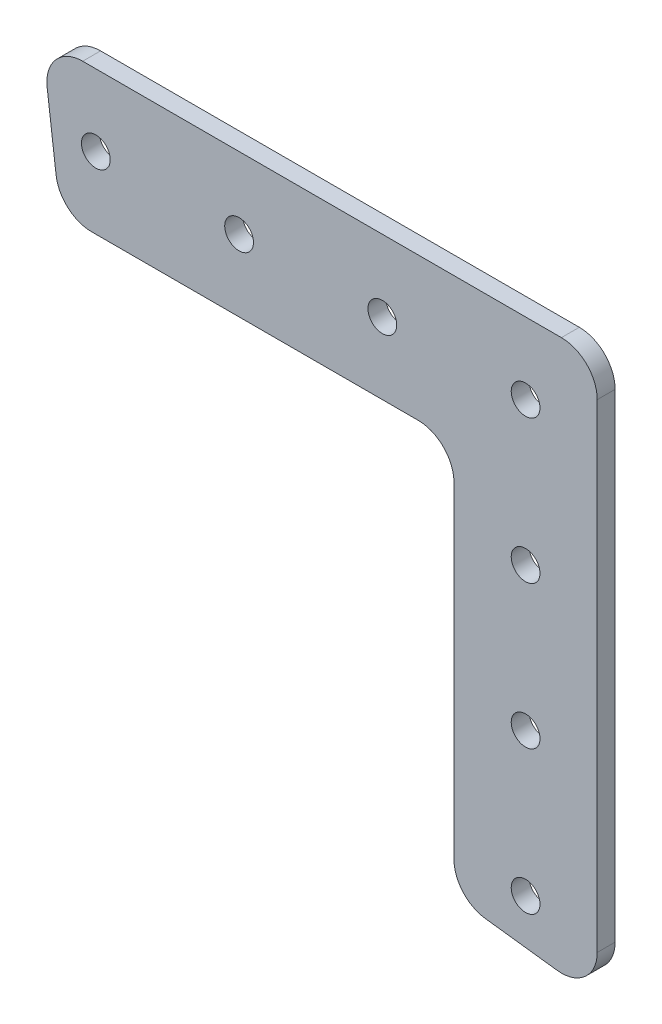
from build123d import *

# Parameters (mm, degrees)
BOSS_EXTRUDE1_DEPTH        = 3.175
FILLET1_R                  = 6.35
F_10_CLEARANCE_HOLE1_D     = 5.1054
F_10_CLEARANCE_HOLE1_DEPTH = 9.906
F_10_CLEARANCE_HOLE1_TIP   = 1.533816902


with BuildPart() as part:
    # Sketch1 → Boss-Extrude1 (new body)
    with BuildSketch(Plane.XY):
        with BuildLine():
            Line((-12.7, 247.65), (-12.7, 317.5))
            Line((-12.7, 317.5), (-82.55, 317.5))
            Line((-82.55, 317.5), (-84.832797429, 335.762379435))
            ThreePointArc((-84.832797429, 335.762379435), (-83.292289329, 340.752446277), (-78.531832912, 342.9))
            Line((-78.531832912, 342.9), (6.35, 342.9))
            ThreePointArc((6.35, 342.9), (10.840128061, 341.040128061), (12.7, 336.55))
            Line((12.7, 336.55), (12.7, 251.668167088))
            ThreePointArc((12.7, 251.668167088), (10.552446277, 246.907710671), (5.562379435, 245.367202571))
            Line((5.562379435, 245.367202571), (-12.7, 247.65))
        make_face()
    extrude(amount=BOSS_EXTRUDE1_DEPTH)

    # Fillet1
    fillet1_edges = [part.edges().sort_by_distance(p)[0] for p in [
        (-12.7, 247.65, 1.5875),
        (-12.7, 317.5, 1.5875),
        (-82.55, 317.5, 1.5875),
    ]]
    fillet(fillet1_edges, radius=FILLET1_R)

    # #10 Clearance Hole1
    with Locations(Plane(origin=(0, 0, 0), x_dir=(-1, 0, 0), z_dir=(0, 0, -1))):
        with Locations((0, 330.2), (0, 304.8), (0, 279.4), (25.4, 330.2), (0, 254), (50.8, 330.2), (76.2, 330.2)):
            Hole(F_10_CLEARANCE_HOLE1_D / 2, depth=F_10_CLEARANCE_HOLE1_DEPTH)
            with Locations((0, 0, -(F_10_CLEARANCE_HOLE1_DEPTH + F_10_CLEARANCE_HOLE1_TIP / 2))):  # 118° drill point
                Cone(0, F_10_CLEARANCE_HOLE1_D / 2, F_10_CLEARANCE_HOLE1_TIP, mode=Mode.SUBTRACT)


solid = part.part
